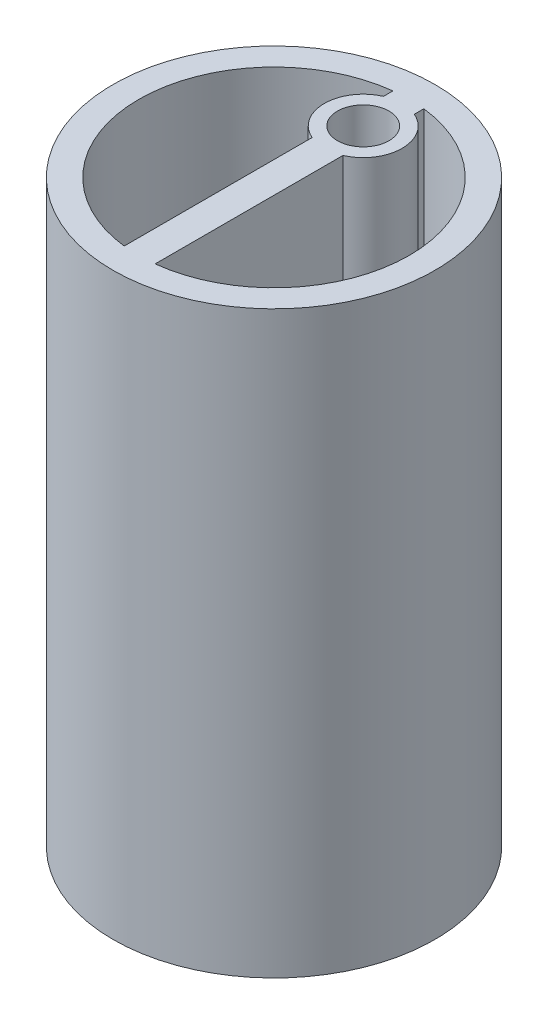
from build123d import *

# Parameters (mm, degrees)
SKETCH1_R           = 12.5
SKETCH1_R_2         = 10.5
BOSS_EXTRUDE1_DEPTH = 45
SKETCH3_W           = 2.4
SKETCH3_H           = 23.000586798
BOSS_EXTRUDE3_DEPTH = 45
SKETCH4_R           = 3.019619096
BOSS_EXTRUDE4_DEPTH = 45
SKETCH5_R           = 2
CUT_EXTRUDE1_DEPTH  = 49.347699015


with BuildPart() as part:
    # Sketch1 → Boss-Extrude1 (new body)
    with BuildSketch(Plane(origin=(0, 0, 0), x_dir=(1, 0, 0), z_dir=(0, 1, 0))):
        with Locations(Location((0, 0, 0), (0, 0, 90))):
            Circle(SKETCH1_R)
        with Locations(Location((0, 0, 0), (0, 0, 90))):
            Circle(SKETCH1_R_2, mode=Mode.SUBTRACT)
    extrude(amount=BOSS_EXTRUDE1_DEPTH)

    # Sketch3 → Boss-Extrude3 (add, through all)
    with BuildSketch(Plane(origin=(0, 45, 0), x_dir=(1, 0, 0), z_dir=(0, 1, 0))):
        with Locations((0, 0.0942647)):
            Rectangle(SKETCH3_W, SKETCH3_H)
    extrude(amount=-BOSS_EXTRUDE3_DEPTH)

    # Sketch4 → Boss-Extrude4 (add, through all)
    with BuildSketch(Plane(origin=(0, 45, 0), x_dir=(1, 0, 0), z_dir=(0, 1, 0))):
        with Locations((0, 6.928455449)):
            Circle(SKETCH4_R)
    extrude(amount=-BOSS_EXTRUDE4_DEPTH)

    # Sketch5 → Cut-Extrude1 (cut, through all)
    with BuildSketch(Plane(origin=(0, 45, 0), x_dir=(1, 0, 0), z_dir=(0, 1, 0))):
        with Locations(Location((0, 6.928455449, 0), (0, 0, 270))):
            Circle(SKETCH5_R)
    extrude(amount=-CUT_EXTRUDE1_DEPTH, mode=Mode.SUBTRACT)


solid = part.part
